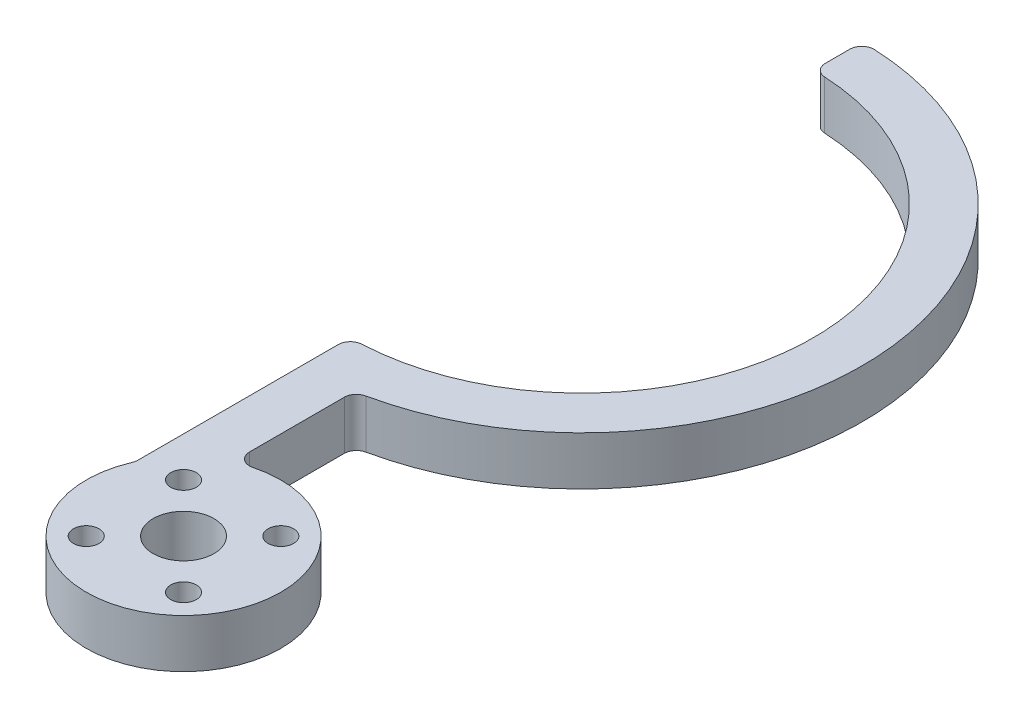
from build123d import *

# Parameters (mm, degrees)
SKETCH1_R           = 2.1
SKETCH1_R_2         = 5
BOSS_EXTRUDE2_DEPTH = 8
FILLET1_R           = 2


with BuildPart() as part:
    # Sketch1 → Boss-Extrude2 (new body)
    with BuildSketch(Plane(origin=(0, 0, 0), x_dir=(1, 0, 0), z_dir=(0, 1, 0))):
        with BuildLine():
            Line((0, 46.1), (0, 38.1))
            ThreePointArc((0, 38.1), (38.1, 0), (0, -38.1))
            Line((0, -38.1), (0, -73.400550657))
            ThreePointArc((0, -73.400550657), (25.844530788, -91.377376201), (8, -65.441325051))
            Line((8, -65.441325051), (8, -45.400550657))
            ThreePointArc((8, -45.400550657), (45.924804764, 4.015259312), (0, 46.1))
        make_face()
        with Locations(Location((22.559764633, -72.034799208, 0), (0, 0, 270))):
            Circle(SKETCH1_R, mode=Mode.SUBTRACT)
        with Locations(Location((22.559764633, -88.034799208, 0), (0, 0, 270))):
            Circle(SKETCH1_R, mode=Mode.SUBTRACT)
        with Locations(Location((6.559764633, -88.034799208, 0), (0, 0, 270))):
            Circle(SKETCH1_R, mode=Mode.SUBTRACT)
        with Locations(Location((6.559764633, -72.034799208, 0), (0, 0, 270))):
            Circle(SKETCH1_R, mode=Mode.SUBTRACT)
        with Locations(Location((14.559764633, -80.034799208, 0), (0, 0, 270))):
            Circle(SKETCH1_R_2, mode=Mode.SUBTRACT)
    extrude(amount=BOSS_EXTRUDE2_DEPTH)

    # Fillet1
    fillet1_edges = [part.edges().sort_by_distance(p)[0] for p in [
        (0, 4, 38.1),
        (0, 4, -38.1),
        (0, 4, -46.1),
        (8, 4, 45.400550657),
        (8, 4, 65.441325051),
        (0, 4, 73.400550657),
    ]]
    fillet(fillet1_edges, radius=FILLET1_R)


solid = part.part
